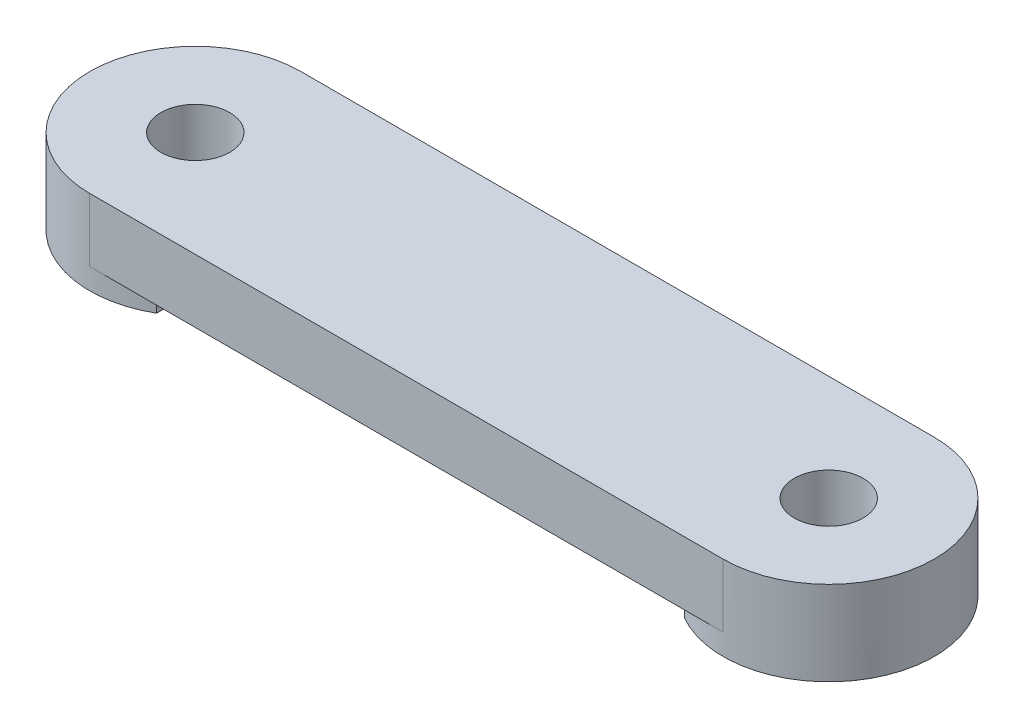
from build123d import *

# Parameters (mm, degrees)
SKETCH1_R             = 5
BOSS_EXTRUDE1_DEPTH   = 1
BOSS_EXTRUDE1_2_DEPTH = 1
BOSS_EXTRUDE2_DEPTH   = 3
F_4_CLEARANCE_HOLE1_D = 3.2639
CUT_EXTRUDE1_DEPTH    = 1


with BuildPart() as part:
    # Sketch1 → Boss-Extrude1 (new body)
    with BuildSketch(Plane(origin=(0, 0, 0), x_dir=(1, 0, 0), z_dir=(0, 1, 0))):
        with Locations(Location((-15, 0, 0), (0, 0, 270))):
            Circle(SKETCH1_R)
    extrude(amount=BOSS_EXTRUDE1_DEPTH)



with BuildPart() as body_2:
    # Sketch1 → Boss-Extrude1 2 (new body)
    with BuildSketch(Plane(origin=(0, 0, 0), x_dir=(1, 0, 0), z_dir=(0, 1, 0))):
        with Locations(Location((15, 0, 0), (0, 0, 270))):
            Circle(SKETCH1_R)
    extrude(amount=BOSS_EXTRUDE1_2_DEPTH)


with BuildPart() as part_1:
    add(part.part)

    add(body_2.part)  # Boss-Extrude2 merges body 2
    # Sketch2 → Boss-Extrude2 (add)
    with BuildSketch(Plane(origin=(0, 1, 0), x_dir=(1, 0, 0), z_dir=(0, 1, 0))):
        with BuildLine():
            Line((-15, -5), (15, -5))
            ThreePointArc((15, -5), (20, 0), (15, 5))
            Line((15, 5), (-15, 5))
            ThreePointArc((-15, 5), (-20, 0), (-15, -5))
        make_face()
    extrude(amount=BOSS_EXTRUDE2_DEPTH)

    # #4 Clearance Hole1 (through all)
    with Locations(Plane(origin=(0, 4, 0), x_dir=(1, 0, 0), z_dir=(0, 1, 0))):
        with Locations((-15, 0), (15, 0)):
            Hole(F_4_CLEARANCE_HOLE1_D / 2)

    # Sketch5 → Cut-Extrude1 (cut)
    with BuildSketch(Plane.XZ):
        with BuildLine():
            Line((12.5, 3), (12.5, 6))
            Line((12.5, 6), (9.5, 6))
            ThreePointArc((9.5, 6), (7.378679656, 5.121320344), (6.5, 3))
            Line((6.5, 3), (6.5, 0))
            Line((6.5, 0), (9.5, 0))
            ThreePointArc((9.5, 0), (11.621320344, 0.878679656), (12.5, 3))
        make_face()
        with BuildLine():
            Line((-12.5, 3), (-12.5, 6))
            Line((-12.5, 6), (-9.5, 6))
            ThreePointArc((-9.5, 6), (-7.378679656, 5.121320344), (-6.5, 3))
            Line((-6.5, 3), (-6.5, 0))
            Line((-6.5, 0), (-9.5, 0))
            ThreePointArc((-9.5, 0), (-11.621320344, 0.878679656), (-12.5, 3))
        make_face()
    extrude(amount=-CUT_EXTRUDE1_DEPTH, mode=Mode.SUBTRACT)


solid = part_1.part
